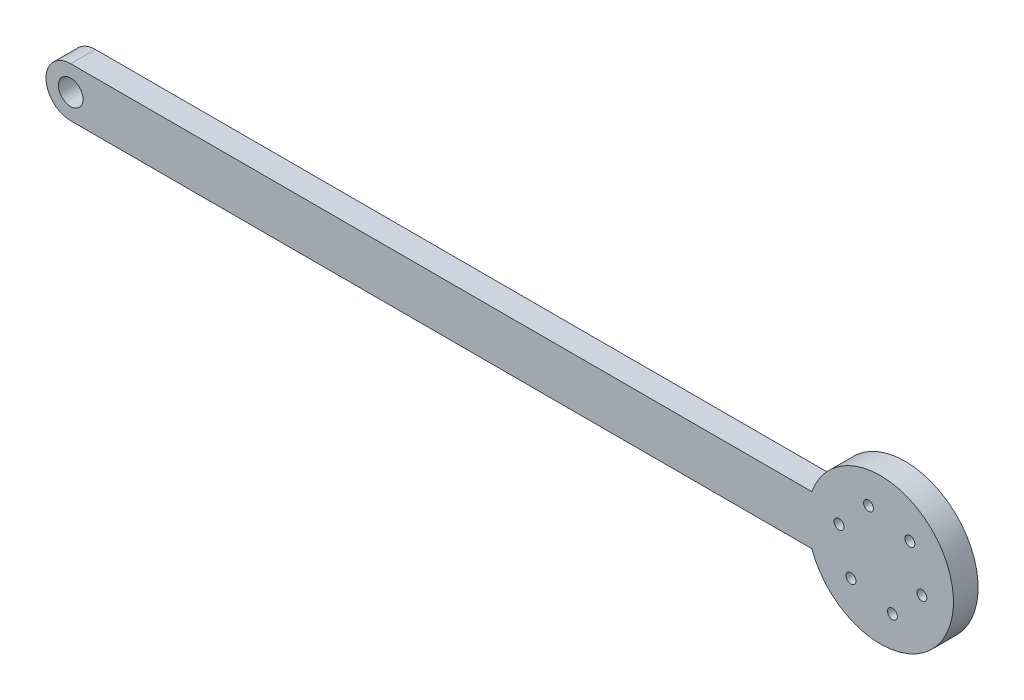
from build123d import *

# Parameters (mm, degrees)
SKETCH_1_R      = 5
SKETCH_1_R_2    = 2
EXTRUDE_1_DEPTH = 10


with BuildPart() as part:
    # 草图1 → 凸台-拉伸1 (new body)
    with BuildSketch(Plane.XY):
        with BuildLine():
            Line((-73.672218906, 28.117910377), (226.327781094, 28.117910377))
            ThreePointArc((226.327781094, 28.117910377), (283.681368031, 18.117910377), (226.327781094, 8.117910377))
            Line((226.327781094, 8.117910377), (-73.672218906, 8.117910377))
            ThreePointArc((-73.672218906, 8.117910377), (-83.672218906, 18.117910377), (-73.672218906, 28.117910377))
        make_face()
        with Locations((-73.672218906, 18.117910377)):
            Circle(SKETCH_1_R, mode=Mode.SUBTRACT)
        with Locations((249.287955983, 34.673576722)):
            Circle(SKETCH_1_R_2, mode=Mode.SUBTRACT)
        with Locations((266.048000376, 30.591492458)):
            Circle(SKETCH_1_R_2, mode=Mode.SUBTRACT)
        with Locations((270.8928339, 14.035826113)):
            Circle(SKETCH_1_R_2, mode=Mode.SUBTRACT)
        with Locations((258.97762303, 1.562244032)):
            Circle(SKETCH_1_R_2, mode=Mode.SUBTRACT)
        with Locations((242.217578637, 5.644328296)):
            Circle(SKETCH_1_R_2, mode=Mode.SUBTRACT)
        with Locations((237.372745113, 22.199994641)):
            Circle(SKETCH_1_R_2, mode=Mode.SUBTRACT)
    extrude(amount=EXTRUDE_1_DEPTH)


solid = part.part
